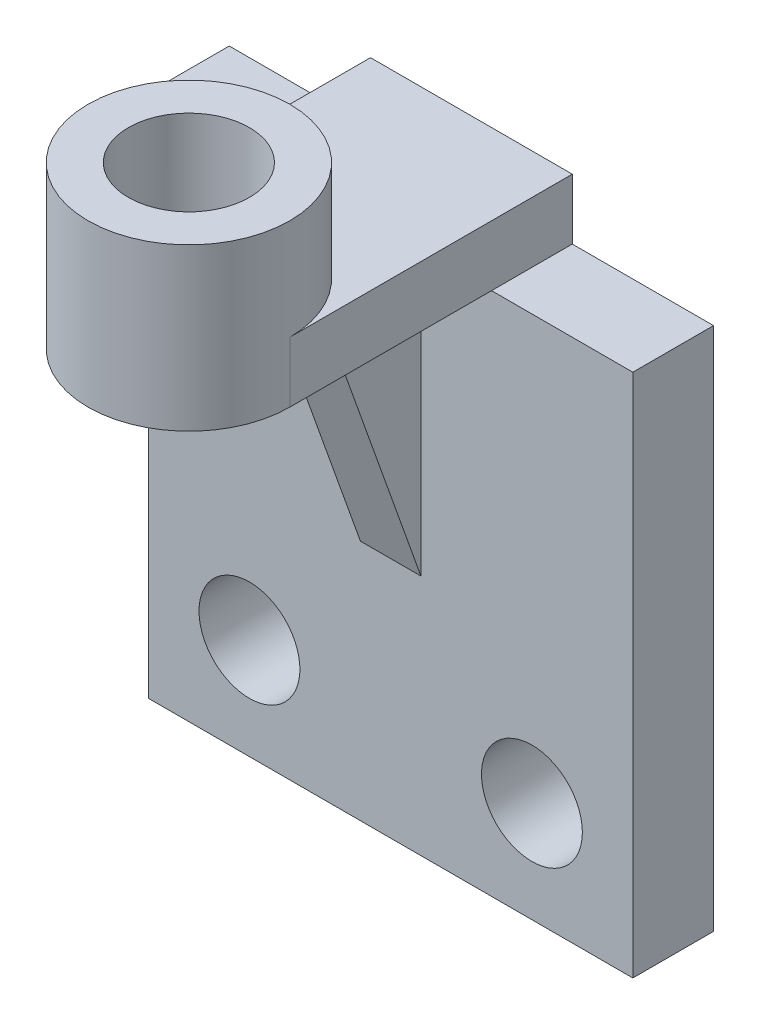
from build123d import *

# Parameters (mm, degrees)
SKETCH_1_W                  = 120
SKETCH_1_H                  = 130
EXTRUDE_1_DEPTH             = 20
SKETCH_2_R                  = 12.5
CUT_EXTRUDE_1_DEPTH         = 91.691785736
SKETCH_3_W                  = 50
SKETCH_3_H                  = 70
EXTRUDE_2_DEPTH             = 15
SKETCH_4_R                  = 25
EXTRUDE_3_DEPTH             = 25
EXTRUDE_3_DIRECTION_2_REACH = 173.828
SKETCH_5_R                  = 15
CUT_EXTRUDE_2_DEPTH         = 204.776838723
RIB_1_REACH                 = 155.786
SKETCH_6_WALL_W             = 383.901473722
SKETCH_6_WALL_H             = 15


with BuildPart() as part:
    # Эскиз1 → Бобышка-Вытянуть1 (new body)
    with BuildSketch(Plane.XY):
        Rectangle(SKETCH_1_W, SKETCH_1_H)
    extrude(amount=EXTRUDE_1_DEPTH)

    # Эскиз2 → Вырез-Вытянуть1 (cut, through all)
    with BuildSketch(Plane.XY.offset(20)):
        with Locations((35, -40)):
            Circle(SKETCH_2_R)
    cut_extrude_1 = extrude(amount=-CUT_EXTRUDE_1_DEPTH, mode=Mode.SUBTRACT)

    # Зеркальное отражение1: Вырез-Вытянуть1 across plane
    add(cut_extrude_1.mirror(Plane(origin=(0, 0, 0), x_dir=(0, 0, 1), z_dir=(1, 0, 0))), mode=Mode.SUBTRACT)

    # Эскиз3 → Бобышка-Вытянуть2 (add)
    with BuildSketch(Plane(origin=(0, 65, 0), x_dir=(1, 0, 0), z_dir=(0, 1, 0))):
        with Locations((0, -35)):
            Rectangle(SKETCH_3_W, SKETCH_3_H)
    extrude(amount=EXTRUDE_2_DEPTH)

    # Эскиз4 → Бобышка-Вытянуть3 (add)
    with BuildSketch(Plane(origin=(0, 80, 0), x_dir=(1, 0, 0), z_dir=(0, 1, 0))):
        with Locations(Location((0, -70, 0), (0, 0, 270))):
            Circle(SKETCH_4_R)
    extrude(amount=EXTRUDE_3_DEPTH)

    # Бобышка-Вытянуть3 direction 2: up to this face of the body (flat: up to its plane)
    extrude_3_direction_2_end = Plane(part.part.faces().sort_by_distance((0, 65, 45))[0])
    # Эскиз4 → Бобышка-Вытянуть3 direction 2 (add, up to the picked face)
    with BuildSketch(Plane(origin=(0, 80, 0), x_dir=(1, 0, 0), z_dir=(0, 1, 0)), mode=Mode.PRIVATE) as extrude_3_direction_2_sk1:
        with Locations(Location((0, -70, 0), (0, 0, 270))):
            Circle(SKETCH_4_R)
    extrude_3_direction_2_tool1 = split(extrude(extrude_3_direction_2_sk1.sketch, amount=-EXTRUDE_3_DIRECTION_2_REACH, mode=Mode.PRIVATE), bisect_by=extrude_3_direction_2_end, keep=Keep.BOTH, mode=Mode.PRIVATE)
    add(extrude_3_direction_2_tool1.solids().sort_by(Axis((0, 80, 70), (0, -1, 0)))[0])

    # Эскиз5 → Вырез-Вытянуть2 (cut, through all)
    with BuildSketch(Plane(origin=(0, 105, 0), x_dir=(1, 0, 0), z_dir=(0, 1, 0))):
        with Locations(Location((0, -70, 0), (0, 0, 270))):
            Circle(SKETCH_5_R)
    extrude(amount=-CUT_EXTRUDE_2_DEPTH, mode=Mode.SUBTRACT)

    # Эскиз6 wall → Ребро1 (add, up to next)
    with BuildSketch(Plane(origin=(0, 30, 32.5), x_dir=(0, -0.941741911595, -0.336336396998), z_dir=(0, 0.336336396998, -0.941741911595)), mode=Mode.PRIVATE) as rib_1_sk1:
        Rectangle(SKETCH_6_WALL_W, SKETCH_6_WALL_H)
    rib_1_tool1 = extrude(rib_1_sk1.sketch, amount=RIB_1_REACH, mode=Mode.PRIVATE) - part.part
    add(rib_1_tool1.solids().sort_by_distance((0, 30, 32.5))[0])


solid = part.part
